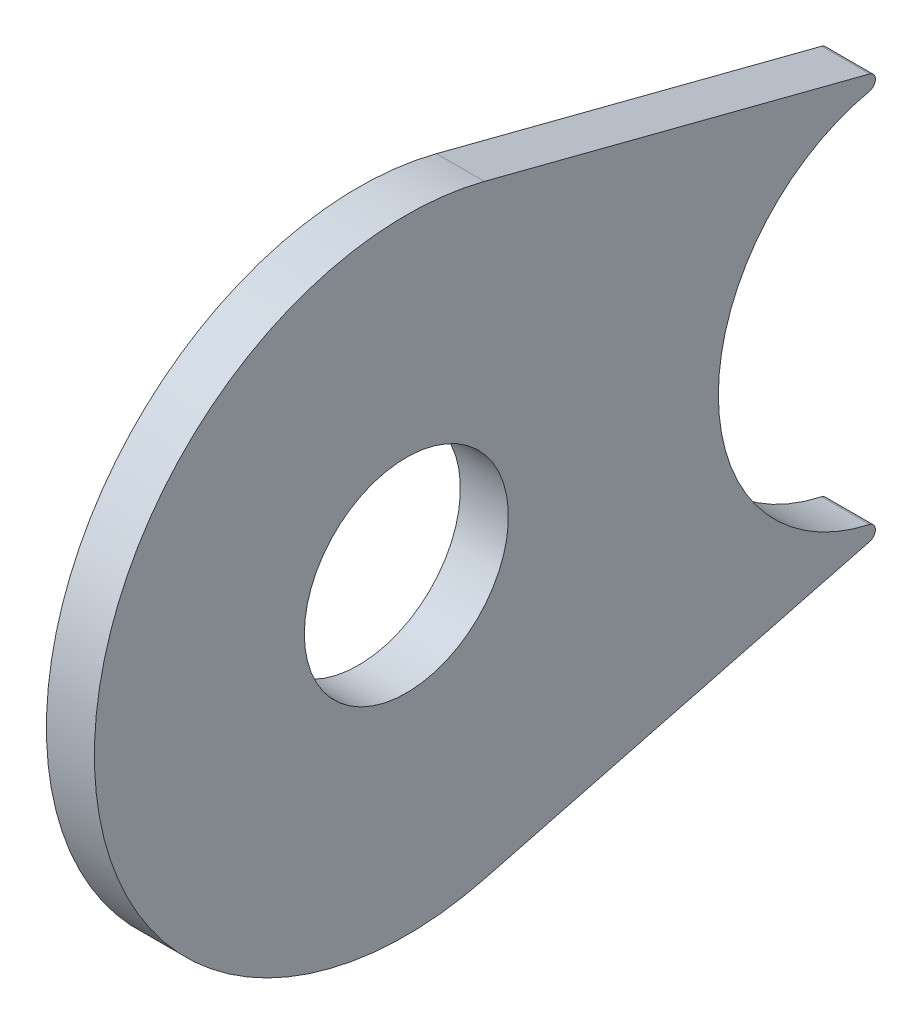
from build123d import *

# Parameters (mm, degrees)
SKETCH1_R             = 6.749999962
BOSS_EXTRUDE1_DEPTH   = 1.5875
FILLET1_R             = 0.508
FILLET2_R             = 0.508
M12_CLEARANCE_HOLE1_D = 13.5


with BuildPart() as part:
    # Sketch1 → Boss-Extrude1 (new, symmetric)
    # profile 1 of 2: a face of its own
    with BuildSketch(Plane(origin=(0, 0, 0), x_dir=(0, 0, -1), z_dir=(1, 0, 0))):
        with BuildLine():
            Line((33.3375, -12.7), (5.163771309, -19.981037814))
            ThreePointArc((5.163771309, -19.981037814), (-20.6375, 0), (5.163771309, 19.981037814))
            Line((5.163771309, 19.981037814), (33.3375, 12.7))
            ThreePointArc((33.3375, 12.7), (20.6375, 0), (33.3375, -12.7))
        make_face()
        Circle(SKETCH1_R, mode=Mode.SUBTRACT)
    # profile 2 of 2: a face of its own
    with BuildSketch(Plane(origin=(0, 0, 0), x_dir=(0, 0, -1), z_dir=(1, 0, 0))):
        Circle(SKETCH1_R)
    extrude(amount=BOSS_EXTRUDE1_DEPTH, both=True)

    # Fillet1
    fillet1_edges = [part.edges().sort_by_distance(p)[0] for p in [
        (0, -12.7, -33.3375),
    ]]
    fillet(fillet1_edges, radius=FILLET1_R)

    # Fillet2
    fillet2_edges = [part.edges().sort_by_distance(p)[0] for p in [
        (0, 12.7, -33.3375),
    ]]
    fillet(fillet2_edges, radius=FILLET2_R)

    # M12 Clearance Hole1 (through all)
    with Locations(Plane.ZY.offset(1.5875)):
        with Locations((0, 0)):
            Hole(M12_CLEARANCE_HOLE1_D / 2)


solid = part.part
